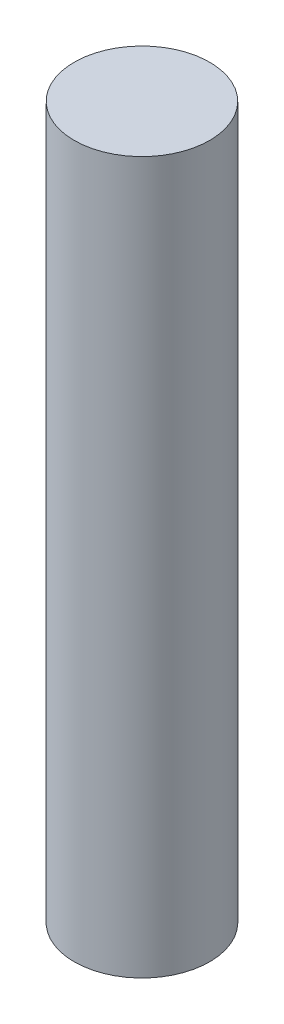
from build123d import *

# Parameters (mm, degrees)
BOSS_EXTRUDE1_DEPTH      = 8
BOSS_EXTRUDE1_DEPTH_BACK = 13
SKETCH1_R                = 2


with BuildPart() as part:
    # Sketch1 → Boss-Extrude1 (new, two sides: drawn at the far end of the back side and taken through both)
    with BuildSketch(Plane(origin=(0, 0, 0), x_dir=(1, 0, 0), z_dir=(0, 1, 0)).offset(-BOSS_EXTRUDE1_DEPTH_BACK)):
        with Locations(Location((0, 0, 0), (0, 0, 270))):
            Circle(SKETCH1_R)
    extrude(amount=BOSS_EXTRUDE1_DEPTH + BOSS_EXTRUDE1_DEPTH_BACK)


solid = part.part
